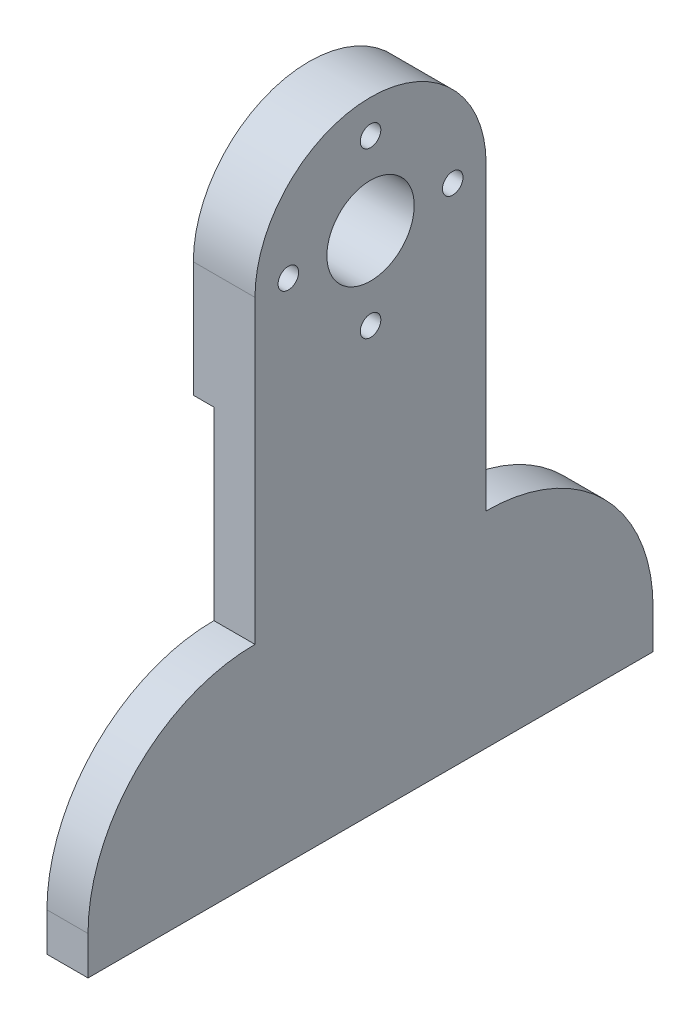
from build123d import *

# Parameters (mm, degrees)
SKETCH1_W           = 50
SKETCH1_H           = 170
BOSS_EXTRUDE1_DEPTH = 55
SKETCH2_W           = 34
SKETCH2_H           = 27
CUT_EXTRUDE1_DEPTH  = 181.416185527
SKETCH3_W           = 10
SKETCH3_H           = 24
SKETCH3_R           = 4.25
SKETCH3_R_2         = 1
CUT_EXTRUDE2_DEPTH  = 186.539753153
SKETCH4_W           = 2
SKETCH4_H           = 24
CUT_EXTRUDE3_DEPTH  = 178.623196683
SKETCH5_W           = 6.25
SKETCH5_H           = 11.25
CUT_EXTRUDE4_DEPTH  = 186.539753153
SKETCH6_W           = 38
SKETCH6_H           = 10
CUT_EXTRUDE5_DEPTH  = 181.416185527
SKETCH8_W           = 13.25
SKETCH8_H           = 2.25
CUT_EXTRUDE7_DEPTH  = 186.539753153
SKETCH9_W           = 34
SKETCH9_H           = 35.25
CUT_EXTRUDE8_DEPTH  = 179.297679458
SKETCH11_W          = 13.25
SKETCH11_H          = 20.25
CUT_EXTRUDE9_DEPTH  = 184.480414486
SKETCH12_W          = 28.5
SKETCH12_H          = 15
BOSS_EXTRUDE2_DEPTH = 8
SKETCH14_W          = 34
SKETCH14_H          = 15
SKETCH14_H_2        = 10.25
BOSS_EXTRUDE3_DEPTH = 13.25
SKETCH16_R          = 4.5
SKETCH16_R_2        = 2.5
CUT_EXTRUDE13_DEPTH = 8
SKETCH17_W          = 16.25
SKETCH17_H          = 18
CUT_EXTRUDE14_DEPTH = 175.384811552
CUT_EXTRUDE15_DEPTH = 175.384811552
SKETCH20_W          = 42
SKETCH20_H          = 6.25
SKETCH20_H_2        = 18
SKETCH20_H_3        = 58.75
CUT_EXTRUDE18_DEPTH = 169.923244404
SKETCH22_R          = 4.5
SKETCH22_R_2        = 1.45
BOSS_EXTRUDE4_DEPTH = 8
SKETCH23_W          = 2
SKETCH23_H          = 10
CUT_EXTRUDE19_DEPTH = 165.352137193
FILLET1_R           = 10
SKETCH24_W          = 55
SKETCH24_H          = 55
CUT_EXTRUDE20_DEPTH = 175.384811552
SKETCH25_W          = 85.852144446
SKETCH25_H          = 76.221294909
CUT_EXTRUDE21_DEPTH = 175.384811552
SKETCH26_W          = 33.011757796
SKETCH26_H          = 68.674094685
CUT_EXTRUDE22_DEPTH = 87.567892431


with BuildPart() as part:
    # Sketch1 → Boss-Extrude1 (new body)
    with BuildSketch(Plane.XY):
        with Locations((0, -85)):
            Rectangle(SKETCH1_W, SKETCH1_H)
    extrude(amount=-BOSS_EXTRUDE1_DEPTH)

    # Sketch2 → Cut-Extrude1 (cut, through all)
    with BuildSketch(Plane.XY):
        with Locations((0, -13.5)):
            Rectangle(SKETCH2_W, SKETCH2_H)
    extrude(amount=-CUT_EXTRUDE1_DEPTH, mode=Mode.SUBTRACT)

    # Sketch3 → Cut-Extrude2 (cut, through all)
    with BuildSketch(Plane(origin=(25, 0, 0), x_dir=(0, 0, -1), z_dir=(1, 0, 0))):
        with Locations((50, -12)):
            Rectangle(SKETCH3_W, SKETCH3_H)
        with Locations((5, -12)):
            Rectangle(SKETCH3_W, SKETCH3_H)
        with Locations(Location((27.5, -12.75, 0), (0, 0, 90))):
            Circle(SKETCH3_R)
        with Locations(Location((35.5, -12.75, 0), (0, 0, 90))):
            Circle(SKETCH3_R_2)
        with Locations(Location((27.5, -4.75, 0), (0, 0, 90))):
            Circle(SKETCH3_R_2)
        with Locations(Location((27.5, -20.75, 0), (0, 0, 90))):
            Circle(SKETCH3_R_2)
        with Locations(Location((19.5, -12.75, 0), (0, 0, 90))):
            Circle(SKETCH3_R_2)
    extrude(amount=-CUT_EXTRUDE2_DEPTH, mode=Mode.SUBTRACT)

    # Sketch4 → Cut-Extrude3 (cut, through all)
    with BuildSketch(Plane.XY.offset(-10)):
        with Locations((-18, -12)):
            Rectangle(SKETCH4_W, SKETCH4_H)
        with Locations((18, -12)):
            Rectangle(SKETCH4_W, SKETCH4_H)
    extrude(amount=-CUT_EXTRUDE3_DEPTH, mode=Mode.SUBTRACT)

    # Sketch5 → Cut-Extrude4 (cut, through all)
    with BuildSketch(Plane(origin=(25, 0, 0), x_dir=(0, 0, -1), z_dir=(1, 0, 0))):
        with BuildLine():
            Line((45, 0), (10, 0))
            Line((10, 0), (10, -12.75))
            Line((10, -12.75), (16.25, -12.75))
            ThreePointArc((16.25, -12.75), (27.5, -1.5), (38.75, -12.75))
            Line((38.75, -12.75), (45, -12.75))
            Line((45, -12.75), (45, 0))
        make_face()
        with Locations((13.125, -18.375)):
            Rectangle(SKETCH5_W, SKETCH5_H)
        with Locations((41.875, -18.375)):
            Rectangle(SKETCH5_W, SKETCH5_H)
    extrude(amount=-CUT_EXTRUDE4_DEPTH, mode=Mode.SUBTRACT)

    # Sketch6 → Cut-Extrude5 (cut, through all)
    with BuildSketch(Plane.XY):
        with Locations((0, -29)):
            Rectangle(SKETCH6_W, SKETCH6_H)
    extrude(amount=-CUT_EXTRUDE5_DEPTH, mode=Mode.SUBTRACT)

    # Sketch8 → Cut-Extrude7 (cut, through all)
    with BuildSketch(Plane(origin=(25, 0, 0), x_dir=(0, 0, -1), z_dir=(1, 0, 0))):
        with BuildLine():
            Line((27.5, -157.5), (27.5, -132.5))
            Line((27.5, -132.5), (13.25, -132.5))
            Line((13.25, -132.5), (13.25, -167.75))
            Line((13.25, -167.75), (17.25, -167.75))
            ThreePointArc((17.25, -167.75), (20.252155493, -160.502155493), (27.5, -157.5))
        make_face()
        with BuildLine():
            Line((41.75, -167.75), (41.75, -132.5))
            Line((41.75, -132.5), (27.5, -132.5))
            Line((27.5, -132.5), (27.5, -157.5))
            ThreePointArc((27.5, -157.5), (34.747844507, -160.502155493), (37.75, -167.75))
            Line((37.75, -167.75), (41.75, -167.75))
        make_face()
        with Locations((48.375, -168.875)):
            Rectangle(SKETCH8_W, SKETCH8_H)
        with Locations((6.625, -168.875)):
            Rectangle(SKETCH8_W, SKETCH8_H)
        with BuildLine():
            Line((17.25, -167.75), (13.25, -167.75))
            Line((13.25, -167.75), (13.25, -170))
            Line((13.25, -170), (17.5, -170))
            ThreePointArc((17.5, -170), (17.31269172, -168.881923142), (17.25, -167.75))
        make_face()
        with BuildLine():
            Line((41.75, -170), (41.75, -167.75))
            Line((41.75, -167.75), (37.75, -167.75))
            ThreePointArc((37.75, -167.75), (37.68730828, -168.881923142), (37.5, -170))
            Line((37.5, -170), (41.75, -170))
        make_face()
        with BuildLine():
            Line((27.5, -167.75), (27.5, -157.5))
            ThreePointArc((27.5, -157.5), (20.252155493, -160.502155493), (17.25, -167.75))
            Line((17.25, -167.75), (27.5, -167.75))
        make_face()
        with BuildLine():
            ThreePointArc((37.75, -167.75), (34.747844507, -160.502155493), (27.5, -157.5))
            Line((27.5, -157.5), (27.5, -167.75))
            Line((27.5, -167.75), (37.75, -167.75))
        make_face()
        with BuildLine():
            Line((27.5, -170), (27.5, -167.75))
            Line((27.5, -167.75), (17.25, -167.75))
            ThreePointArc((17.25, -167.75), (17.31269172, -168.881923142), (17.5, -170))
            Line((17.5, -170), (27.5, -170))
        make_face()
        with BuildLine():
            ThreePointArc((37.5, -170), (37.68730828, -168.881923142), (37.75, -167.75))
            Line((37.75, -167.75), (27.5, -167.75))
            Line((27.5, -167.75), (27.5, -170))
            Line((27.5, -170), (37.5, -170))
        make_face()
    extrude(amount=-CUT_EXTRUDE7_DEPTH, mode=Mode.SUBTRACT)

    # Sketch9 → Cut-Extrude8 (cut, through all)
    with BuildSketch(Plane.XY):
        with Locations((0, -150.125)):
            Rectangle(SKETCH9_W, SKETCH9_H)
    extrude(amount=-CUT_EXTRUDE8_DEPTH, mode=Mode.SUBTRACT)

    # Sketch11 → Cut-Extrude9 (cut, through all)
    with BuildSketch(Plane(origin=(25, 0, 0), x_dir=(0, 0, -1), z_dir=(1, 0, 0))):
        with BuildLine():
            ThreePointArc((17.25, -167.75), (20.252155493, -160.502155493), (27.5, -157.5))
            Line((27.5, -157.5), (27.5, -147.5))
            Line((27.5, -147.5), (13.25, -147.5))
            Line((13.25, -147.5), (13.25, -167.75))
            Line((13.25, -167.75), (17.25, -167.75))
        make_face()
        with BuildLine():
            Line((27.5, -147.5), (27.5, -157.5))
            ThreePointArc((27.5, -157.5), (34.747844507, -160.502155493), (37.75, -167.75))
            Line((37.75, -167.75), (41.75, -167.75))
            Line((41.75, -167.75), (41.75, -147.5))
            Line((41.75, -147.5), (27.5, -147.5))
        make_face()
        with Locations((48.375, -157.625)):
            Rectangle(SKETCH11_W, SKETCH11_H)
        with Locations((6.625, -157.625)):
            Rectangle(SKETCH11_W, SKETCH11_H)
    extrude(amount=-CUT_EXTRUDE9_DEPTH, mode=Mode.SUBTRACT)

    # Sketch12 → Boss-Extrude2 (add)
    with BuildSketch(Plane(origin=(25, 0, 0), x_dir=(0, 0, -1), z_dir=(1, 0, 0))):
        with Locations((27.5, -140)):
            Rectangle(SKETCH12_W, SKETCH12_H)
    boss_extrude2 = extrude(amount=-BOSS_EXTRUDE2_DEPTH)

    # Mirror1: Boss-Extrude2 across plane
    add(boss_extrude2.mirror(Plane(origin=(0, 0, 0), x_dir=(0, 0, 1), z_dir=(1, 0, 0))))

    # Sketch14 → Boss-Extrude3 (add)
    with BuildSketch(Plane.XY):
        with Locations((0, -140)):
            Rectangle(SKETCH14_W, SKETCH14_H)
        with Locations((0, -152.625)):
            Rectangle(SKETCH14_W, SKETCH14_H_2)
    boss_extrude3 = extrude(amount=-BOSS_EXTRUDE3_DEPTH)

    # Mirror2: Boss-Extrude3 across plane
    add(boss_extrude3.mirror(Plane.XY.offset(-27.5)))

    # Sketch16 → Cut-Extrude13 (cut)
    # profile 1 of 3: a face of its own
    with BuildSketch(Plane(origin=(25, 0, 0), x_dir=(0, 0, -1), z_dir=(1, 0, 0))):
        with Locations(Location((16.5, -135.75, 0), (0, 0, 90))):
            Circle(SKETCH16_R)
        with Locations((16.5, -135.75)):
            Circle(SKETCH16_R_2, mode=Mode.SUBTRACT)
    # profile 2 of 3: a face of its own
    with BuildSketch(Plane(origin=(25, 0, 0), x_dir=(0, 0, -1), z_dir=(1, 0, 0))):
        with Locations((16.5, -135.75)):
            Circle(SKETCH16_R_2)
    # profile 3 of 3: a face of its own
    with BuildSketch(Plane(origin=(25, 0, 0), x_dir=(0, 0, -1), z_dir=(1, 0, 0))):
        with Locations(Location((38.5, -135.75, 0), (0, 0, 90))):
            Circle(SKETCH16_R)
    cut_extrude13 = extrude(amount=-CUT_EXTRUDE13_DEPTH, mode=Mode.SUBTRACT)

    # Mirror3: Cut-Extrude13 across plane
    add(cut_extrude13.mirror(Plane(origin=(0, 0, 0), x_dir=(0, 0, 1), z_dir=(1, 0, 0))), mode=Mode.SUBTRACT)

    # Sketch17 → Cut-Extrude14 (cut, through all)
    with BuildSketch(Plane(origin=(25, 0, 0), x_dir=(0, 0, -1), z_dir=(1, 0, 0))):
        with Locations((46.875, -33)):
            Rectangle(SKETCH17_W, SKETCH17_H)
        with Locations((8.125, -33)):
            Rectangle(SKETCH17_W, SKETCH17_H)
    extrude(amount=-CUT_EXTRUDE14_DEPTH, mode=Mode.SUBTRACT)

    # Sketch18 → Cut-Extrude15 (cut, through all)
    with BuildSketch(Plane(origin=(25, 0, 0), x_dir=(0, 0, -1), z_dir=(1, 0, 0))):
        with BuildLine():
            ThreePointArc((0, -58.25), (4.759514806, -46.759514806), (16.25, -42))
            Line((16.25, -42), (0, -42))
            Line((0, -42), (0, -58.25))
        make_face()
        with BuildLine():
            Line((55, -42), (38.75, -42))
            ThreePointArc((38.75, -42), (50.240485194, -46.759514806), (55, -58.25))
            Line((55, -58.25), (55, -42))
        make_face()
    extrude(amount=-CUT_EXTRUDE15_DEPTH, mode=Mode.SUBTRACT)

    # Sketch20 → Cut-Extrude18 (cut, through all)
    with BuildSketch(Plane(origin=(0, 0, -55), x_dir=(-1, 0, 0), z_dir=(0, 0, -1))):
        with Locations((0, -55.125)):
            Rectangle(SKETCH20_W, SKETCH20_H)
        with Locations((0, -43)):
            Rectangle(SKETCH20_W, SKETCH20_H_2)
        with Locations((0, -87.625)):
            Rectangle(SKETCH20_W, SKETCH20_H_3)
    extrude(amount=-CUT_EXTRUDE18_DEPTH, mode=Mode.SUBTRACT)

    # Sketch22 → Boss-Extrude4 (add)
    # profile 1 of 2: a face of its own
    with BuildSketch(Plane.ZY.offset(25)):
        with Locations(Location((-38.5, -135.75, 0), (0, 0, 90))):
            Circle(SKETCH22_R)
        with Locations(Location((-38.5, -135.75, 0), (0, 0, 270))):
            Circle(SKETCH22_R_2, mode=Mode.SUBTRACT)
    # profile 2 of 2: a face of its own
    with BuildSketch(Plane.ZY.offset(25)):
        with Locations(Location((-16.5, -135.75, 0), (0, 0, 90))):
            Circle(SKETCH22_R)
        with Locations(Location((-16.5, -135.75, 0), (0, 0, 270))):
            Circle(SKETCH22_R_2, mode=Mode.SUBTRACT)
    boss_extrude4 = extrude(amount=-BOSS_EXTRUDE4_DEPTH)

    # Mirror4: Boss-Extrude4 across plane
    add(boss_extrude4.mirror(Plane(origin=(0, 0, 0), x_dir=(0, 0, 1), z_dir=(1, 0, 0))))

    # Sketch23 → Cut-Extrude19 (cut, through all)
    with BuildSketch(Plane(origin=(0, 0, -38.75), x_dir=(-1, 0, 0), z_dir=(0, 0, -1))):
        with Locations((-20, -29)):
            Rectangle(SKETCH23_W, SKETCH23_H)
        with Locations((20, -29)):
            Rectangle(SKETCH23_W, SKETCH23_H)
    extrude(amount=-CUT_EXTRUDE19_DEPTH, mode=Mode.SUBTRACT)

    # Fillet1
    fillet1_edges = [part.edges().sort_by_distance(p)[0] for p in [
        (0, -157.75, 0),
        (0, -157.75, -55),
    ]]
    fillet(fillet1_edges, radius=FILLET1_R)

    # Sketch24 → Cut-Extrude20 (cut, through all)
    with BuildSketch(Plane.ZY.offset(25)):
        with Locations((-27.5, -89.5)):
            Rectangle(SKETCH24_W, SKETCH24_H)
    extrude(amount=-CUT_EXTRUDE20_DEPTH, mode=Mode.SUBTRACT)


with BuildPart() as cut_extrude20_piece_1:
    # of the separate pieces the step leaves, piece 1, a body of its own (cut_extrude20_pieces)
    add(part.part.solids().sort_by_distance((17, -147.75, 0))[0])

    # Sketch25 → Cut-Extrude21 (cut, through all)
    with BuildSketch(Plane.ZY.offset(25)):
        with Locations((-29.151002778, -129.567834029)):
            Rectangle(SKETCH25_W, SKETCH25_H)
    extrude(amount=-CUT_EXTRUDE21_DEPTH, mode=Mode.SUBTRACT)


with BuildPart() as cut_extrude20_piece_2:
    # of the separate pieces the step leaves, piece 2, a body of its own (cut_extrude20_pieces)
    add(part.part.solids().sort_by_distance((25, -58.25, 0))[0])


with BuildPart() as cut_extrude20_piece_3:
    # of the separate pieces the step leaves, piece 3, a body of its own (cut_extrude20_pieces)
    add(part.part.solids().sort_by_distance((-25, -62, 0))[0])

    # Sketch26 → Cut-Extrude22 (cut, through all)
    with BuildSketch(Plane.XY):
        with Locations((-19.418686116, -31.078989241)):
            Rectangle(SKETCH26_W, SKETCH26_H)
    extrude(amount=-CUT_EXTRUDE22_DEPTH, mode=Mode.SUBTRACT)


solid = cut_extrude20_piece_2.part
